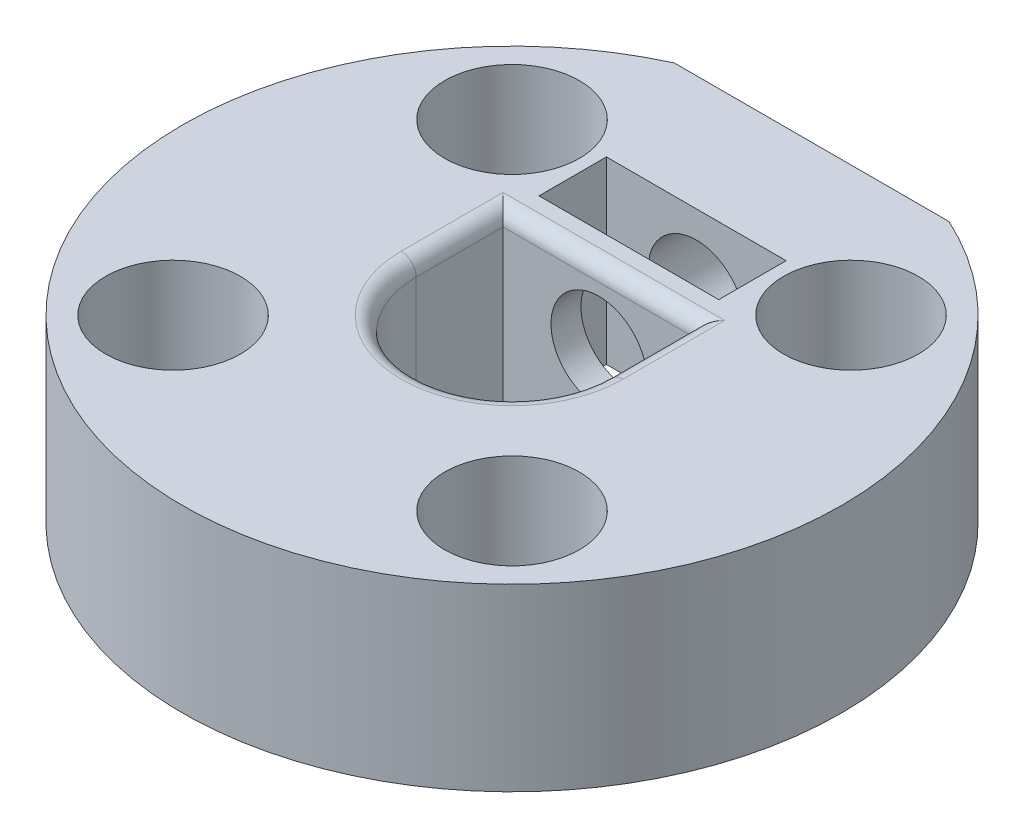
from build123d import *

# Parameters (mm, degrees)
BOSS_EXTRU_1_DEPTH                              = 6
CHAMBRAGE_POUR_VIS_T_TE_CYLINDRIQUE_D           = 2.5
CHAMBRAGE_POUR_VIS_T_TE_CYLINDRIQUE_CBORE_D     = 4.5
CHAMBRAGE_POUR_VIS_T_TE_CYLINDRIQUE_CBORE_DEPTH = 4.5
CONG_1_R                                        = 0.5
ESQUISSE6_R                                     = 1.6
ENL_V_MAT_EXTRU_1_DEPTH                         = 17.673332037
ESQUISSE7_W                                     = 6
ESQUISSE7_H                                     = 2.25
ENL_V_MAT_EXTRU_2_DEPTH                         = 17.673332001


with BuildPart() as part:
    # Esquisse1 → Boss.-Extru.1 (new body)
    with BuildSketch(Plane(origin=(0, 0, 0), x_dir=(1, 0, 0), z_dir=(0, 1, 0))):
        with BuildLine():
            Line((4.582575695, 10), (-4.582575695, 10))
            ThreePointArc((-4.582575695, 10), (0, -11), (4.582575695, 10))
        make_face()
        with BuildLine():
            Line((-3.2, 0), (-3.2, 2.9))
            Line((-3.2, 2.9), (3.2, 2.9))
            Line((3.2, 2.9), (3.2, 0))
            ThreePointArc((3.2, 0), (0, -3.2), (-3.2, 0))
        make_face(mode=Mode.SUBTRACT)
    extrude(amount=BOSS_EXTRU_1_DEPTH)

    # Chambrage pour vis à tête cylindrique à 6 pans creux (ou vis CHC) M21 (through all)
    with Locations(Plane(origin=(0, 6, 0), x_dir=(1, 0, 0), z_dir=(0, 1, 0))):
        with Locations((5.656854249, 5.656854249), (5.656854249, -5.656854249), (-5.656854249, -5.656854249), (-5.656854249, 5.656854249), (0, 0)):
            CounterBoreHole(CHAMBRAGE_POUR_VIS_T_TE_CYLINDRIQUE_D / 2, CHAMBRAGE_POUR_VIS_T_TE_CYLINDRIQUE_CBORE_D / 2, CHAMBRAGE_POUR_VIS_T_TE_CYLINDRIQUE_CBORE_DEPTH)

    # Congé1
    cong_1_edges = [part.edges().sort_by_distance(p)[0] for p in [
        (0, 6, 3.2),
        (3.2, 6, -1.45),
        (0, 6, -2.9),
        (-3.2, 6, -1.45),
    ]]
    fillet(cong_1_edges, radius=CONG_1_R)

    # Esquisse6 → Enlèv. mat.-Extru.1 (cut, through all)
    with BuildSketch(Plane.XY):
        with Locations((0, 3.5)):
            Circle(ESQUISSE6_R)
    extrude(amount=-ENL_V_MAT_EXTRU_1_DEPTH, mode=Mode.SUBTRACT)

    # Esquisse7 → Enlèv. mat.-Extru.2 (cut, through all)
    with BuildSketch(Plane(origin=(0, 6, 0), x_dir=(1, 0, 0), z_dir=(0, 1, 0))):
        with Locations((0, 5.025)):
            Rectangle(ESQUISSE7_W, ESQUISSE7_H)
    extrude(amount=-ENL_V_MAT_EXTRU_2_DEPTH, mode=Mode.SUBTRACT)


solid = part.part
